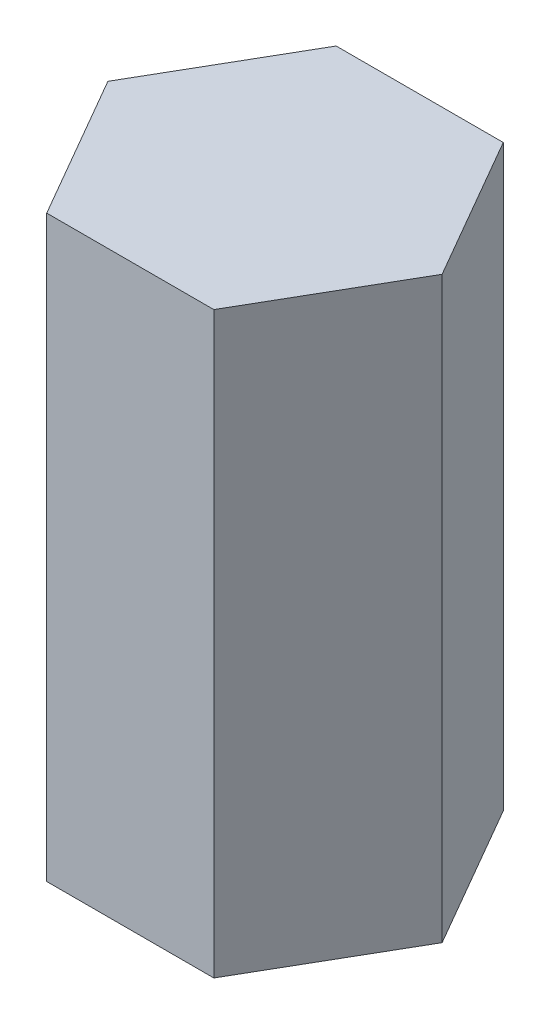
from build123d import *

# Parameters (mm, degrees)
EXTRUDE_1_DEPTH = 30


with BuildPart() as part:
    # 草图1 → 凸台-拉伸1 (new body)
    with BuildSketch(Plane(origin=(0, 0, 0), x_dir=(1, 0, 0), z_dir=(0, 1, 0))):
        Polygon((8.660254038, 0), (4.330127019, 7.5), (-4.330127019, 7.5), (-8.660254038, 0), (-4.330127019, -7.5), (4.330127019, -7.5), align=None)
    extrude(amount=EXTRUDE_1_DEPTH)


solid = part.part
